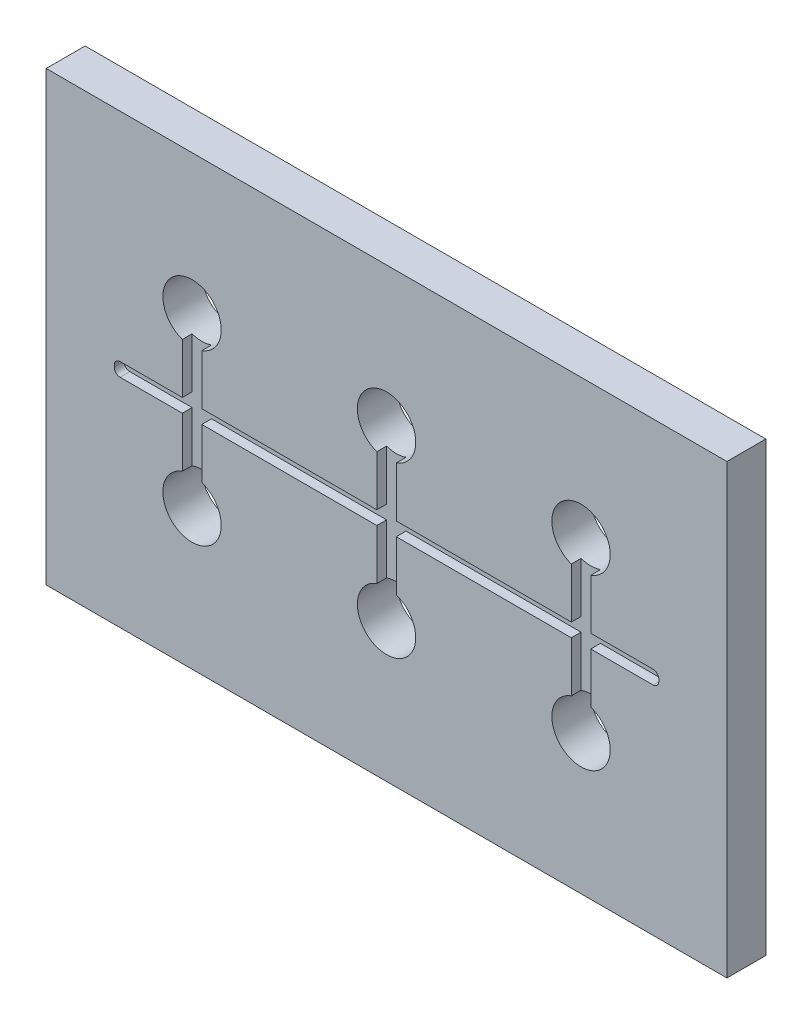
from build123d import *

# Parameters (mm, degrees)
SKETCH1_W           = 350
SKETCH1_H           = 230
BOSS_EXTRUDE1_DEPTH = 20
CUT_EXTRUDE1_DEPTH  = 5
SKETCH4_R           = 15
CUT_EXTRUDE2_DEPTH  = 20


with BuildPart() as part:
    # Sketch1 → Boss-Extrude1 (new body)
    with BuildSketch(Plane.XY):
        with Locations((11.12716763, -28.294797688)):
            Rectangle(SKETCH1_W, SKETCH1_H)
    extrude(amount=BOSS_EXTRUDE1_DEPTH)

    # Sketch3 → Cut-Extrude1 (cut)
    with BuildSketch(Plane.XY.offset(20)):
        with BuildLine():
            Line((-125.87283237, -24.794797688), (-93.87283237, -24.794797688))
            Line((-93.87283237, -24.794797688), (-93.87283237, 5.205202312))
            Line((-93.87283237, 5.205202312), (-83.87283237, 5.205202312))
            Line((-83.87283237, 5.205202312), (-83.87283237, -24.794797688))
            Line((-83.87283237, -24.794797688), (6.12716763, -24.794797688))
            Line((6.12716763, -24.794797688), (6.12716763, 5.205202312))
            Line((6.12716763, 5.205202312), (16.12716763, 5.205202312))
            Line((16.12716763, 5.205202312), (16.12716763, -24.794797688))
            Line((16.12716763, -24.794797688), (106.12716763, -24.794797688))
            Line((106.12716763, -24.794797688), (106.12716763, 5.205202312))
            Line((106.12716763, 5.205202312), (116.12716763, 5.205202312))
            Line((116.12716763, 5.205202312), (116.12716763, -24.794797688))
            Line((116.12716763, -24.794797688), (148.12716763, -24.794797688))
            ThreePointArc((148.12716763, -24.794797688), (150.248487974, -25.673477344), (151.12716763, -27.794797688))
            Line((151.12716763, -27.794797688), (151.12716763, -28.794797688))
            ThreePointArc((151.12716763, -28.794797688), (150.248487974, -30.916118031), (148.12716763, -31.794797688))
            Line((148.12716763, -31.794797688), (116.12716763, -31.794797688))
            Line((116.12716763, -31.794797688), (116.12716763, -61.794797688))
            Line((116.12716763, -61.794797688), (106.12716763, -61.794797688))
            Line((106.12716763, -61.794797688), (106.12716763, -31.794797688))
            Line((106.12716763, -31.794797688), (16.12716763, -31.794797688))
            Line((16.12716763, -31.794797688), (16.12716763, -61.794797688))
            Line((16.12716763, -61.794797688), (6.12716763, -61.794797688))
            Line((6.12716763, -61.794797688), (6.12716763, -31.794797688))
            Line((6.12716763, -31.794797688), (-83.87283237, -31.794797688))
            Line((-83.87283237, -31.794797688), (-83.87283237, -61.794797688))
            Line((-83.87283237, -61.794797688), (-93.87283237, -61.794797688))
            Line((-93.87283237, -61.794797688), (-93.87283237, -31.794797688))
            Line((-93.87283237, -31.794797688), (-125.87283237, -31.794797688))
            ThreePointArc((-125.87283237, -31.794797688), (-127.994152714, -30.916118031), (-128.87283237, -28.794797688))
            Line((-128.87283237, -28.794797688), (-128.87283237, -27.794797688))
            ThreePointArc((-128.87283237, -27.794797688), (-127.994152714, -25.673477344), (-125.87283237, -24.794797688))
        make_face()
    extrude(amount=-CUT_EXTRUDE1_DEPTH, mode=Mode.SUBTRACT)

    # Sketch4 → Cut-Extrude2 (cut)
    with BuildSketch(Plane.XY.offset(20)):
        with Locations((111.12716763, 15.205202312)):
            Circle(SKETCH4_R)
        with Locations((11.12716763, 15.205202312)):
            Circle(SKETCH4_R)
        with Locations((-88.87283237, 15.205202312)):
            Circle(SKETCH4_R)
        with Locations((111.12716763, -71.794797688)):
            Circle(SKETCH4_R)
        with Locations((11.12716763, -71.794797688)):
            Circle(SKETCH4_R)
        with Locations((-88.87283237, -71.794797688)):
            Circle(SKETCH4_R)
    extrude(amount=-CUT_EXTRUDE2_DEPTH, mode=Mode.SUBTRACT)


solid = part.part
